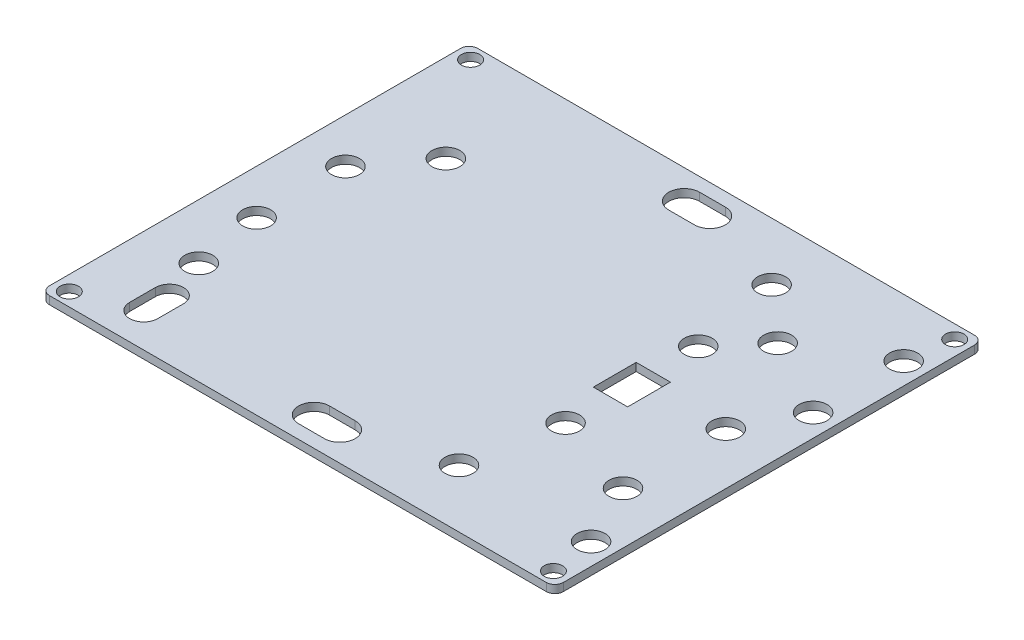
from build123d import *

# Parameters (mm, degrees)
SKETCH1_W               = 152.4
SKETCH1_H               = 127
BOSS_EXTRUDE1_DEPTH     = 2.3622
FILLET1_R               = 2.54
SKETCH9_R               = 4.15
CUT_EXTRUDE8_DEPTH      = 100.218294628
CUT_EXTRUDE11_DEPTH     = 100.218294628
CUT_EXTRUDE12_DEPTH     = 100.218294628
SKETCH16_R              = 4.15
CUT_EXTRUDE14_DEPTH     = 100.218294628
SKETCH17_R              = 2.7305
CUT_EXTRUDE16_DEPTH     = 100.218294628
MIRROR7_COPY_1_SKETCH_R = 2.7305
MIRROR7_COPY_1_DEPTH    = 100.218294628
SKETCH26_W              = 10.16
SKETCH26_H              = 12.7
CUT_EXTRUDE26_DEPTH     = 100.218294628
SKETCH27_R              = 4.15
CUT_EXTRUDE27_DEPTH     = 100.218294628
SKETCH29_R              = 4.15
CUT_EXTRUDE28_DEPTH     = 100.218294628
SKETCH30_R              = 4.15
CUT_EXTRUDE29_DEPTH     = 100.218294628
SKETCH31_R              = 4.15
CUT_EXTRUDE30_DEPTH     = 100.218294628


with BuildPart() as part:
    # Sketch1 → Boss-Extrude1 (new body)
    with BuildSketch(Plane(origin=(0, 0, 0), x_dir=(1, 0, 0), z_dir=(0, 1, 0))):
        Rectangle(SKETCH1_W, SKETCH1_H)
    extrude(amount=BOSS_EXTRUDE1_DEPTH)

    # Fillet1
    fillet1_edges = [part.edges().sort_by_distance(p)[0] for p in [
        (76.2, 1.1811, 63.5),
        (76.2, 1.1811, -63.5),
        (-76.2, 1.1811, -63.5),
        (-76.2, 1.1811, 63.5),
    ]]
    fillet(fillet1_edges, radius=FILLET1_R)

    # Sketch9 → Cut-Extrude8 (cut, through all)
    with BuildSketch(Plane.XZ):
        with Locations((60.8584, 27.94)):
            Circle(SKETCH9_R)
        with Locations((60.8584, -2.54)):
            Circle(SKETCH9_R)
    extrude(amount=-CUT_EXTRUDE8_DEPTH, mode=Mode.SUBTRACT)

    # Sketch12 → Cut-Extrude11 (cut, through all)
    with BuildSketch(Plane.XZ):
        with BuildLine():
            Line((-3.81, 59.465627528), (3.81, 59.465627528))
            ThreePointArc((3.81, 59.465627528), (8.387405636, 54.888221892), (3.81, 50.310816255))
            Line((3.81, 50.310816255), (-3.81, 50.310816255))
            ThreePointArc((-3.81, 50.310816255), (-8.387405636, 54.888221892), (-3.81, 59.465627528))
        make_face()
    cut_extrude11 = extrude(amount=-CUT_EXTRUDE11_DEPTH, mode=Mode.SUBTRACT)

    # Mirror3: Cut-Extrude11 across plane
    add(cut_extrude11.mirror(Plane.XY), mode=Mode.SUBTRACT)

    # Sketch13 → Cut-Extrude12 (cut, through all)
    with BuildSketch(Plane(origin=(0, 0, 0), x_dir=(-1, 0, 0), z_dir=(0, -1, 0))):
        with BuildLine():
            Line((60.052874771, -45.72), (60.052874771, -53.34))
            ThreePointArc((60.052874771, -53.34), (55.88, -57.512874771), (51.707125229, -53.34))
            Line((51.707125229, -53.34), (51.707125229, -45.72))
            ThreePointArc((51.707125229, -45.72), (55.88, -41.547125229), (60.052874771, -45.72))
        make_face()
    extrude(amount=-CUT_EXTRUDE12_DEPTH, mode=Mode.SUBTRACT)

    # Sketch16 → Cut-Extrude14 (cut, through all)
    with BuildSketch(Plane(origin=(0, 0, 0), x_dir=(-1, 0, 0), z_dir=(0, -1, 0))):
        with Locations((-69.599893995, 19.704320306)):
            Circle(SKETCH16_R)
        with Locations((-46.522565834, 32.264238523)):
            Circle(SKETCH16_R)
    extrude(amount=-CUT_EXTRUDE14_DEPTH, mode=Mode.SUBTRACT)

    # Sketch17 → Cut-Extrude16 (cut, through all)
    with BuildSketch(Plane.XZ):
        with Locations((71.794813785, 59.510435834)):
            Circle(SKETCH17_R)
    cut_extrude16 = extrude(amount=-CUT_EXTRUDE16_DEPTH, mode=Mode.SUBTRACT)

    # Mirror6: Cut-Extrude16 across plane
    add(cut_extrude16.mirror(Plane(origin=(0, 0, 0), x_dir=(0, 0, 1), z_dir=(1, 0, 0))), mode=Mode.SUBTRACT)

    # Mirror7: Cut-Extrude16 across plane
    add(cut_extrude16.mirror(Plane.XY), mode=Mode.SUBTRACT)

    # Mirror7 copy 1 sketch → Mirror7 copy 1 (cut, through all)
    with BuildSketch(Plane(origin=(0, 0, 0), x_dir=(-1, 0, 0), z_dir=(0, -1, 0))):
        with Locations((71.794813785, 59.510435834)):
            Circle(MIRROR7_COPY_1_SKETCH_R)
    extrude(amount=-MIRROR7_COPY_1_DEPTH, mode=Mode.SUBTRACT)

    # Sketch26 → Cut-Extrude26 (cut, through all)
    with BuildSketch(Plane(origin=(0, 2.3622, 0), x_dir=(1, 0, 0), z_dir=(0, 1, 0))):
        with Locations((35.56, 0)):
            Rectangle(SKETCH26_W, SKETCH26_H)
    extrude(amount=-CUT_EXTRUDE26_DEPTH, mode=Mode.SUBTRACT)

    # Sketch27 → Cut-Extrude27 (cut, through all)
    with BuildSketch(Plane.XZ):
        with Locations((-59.831398438, 33.060447312)):
            Circle(SKETCH27_R)
        with Locations((-50.09170874, -30.48)):
            Circle(SKETCH27_R)
    extrude(amount=-CUT_EXTRUDE27_DEPTH, mode=Mode.SUBTRACT)

    # Sketch29 → Cut-Extrude28 (cut, through all)
    with BuildSketch(Plane(origin=(0, 2.3622, 0), x_dir=(1, 0, 0), z_dir=(0, 1, 0))):
        with Locations((35.56, 19.681240592)):
            Circle(SKETCH29_R)
        with Locations((35.56, -19.681240592)):
            Circle(SKETCH29_R)
    extrude(amount=-CUT_EXTRUDE28_DEPTH, mode=Mode.SUBTRACT)

    # Sketch30 → Cut-Extrude29 (cut, through all)
    with BuildSketch(Plane(origin=(0, 2.3622, 0), x_dir=(1, 0, 0), z_dir=(0, 1, 0))):
        with Locations((69.803274088, -46.355)):
            Circle(SKETCH30_R)
        with Locations((30.63517528, -46.355)):
            Circle(SKETCH30_R)
    cut_extrude29 = extrude(amount=-CUT_EXTRUDE29_DEPTH, mode=Mode.SUBTRACT)

    # Mirror8: Cut-Extrude29 across plane
    add(cut_extrude29.mirror(Plane.XY), mode=Mode.SUBTRACT)

    # Sketch31 → Cut-Extrude30 (cut, through all)
    with BuildSketch(Plane(origin=(0, 2.3622, 0), x_dir=(1, 0, 0), z_dir=(0, 1, 0))):
        with Locations((-62.942335235, -12.79551579)):
            Circle(SKETCH31_R)
        with Locations((-62.942335235, 13.549600091)):
            Circle(SKETCH31_R)
    extrude(amount=-CUT_EXTRUDE30_DEPTH, mode=Mode.SUBTRACT)


solid = part.part
